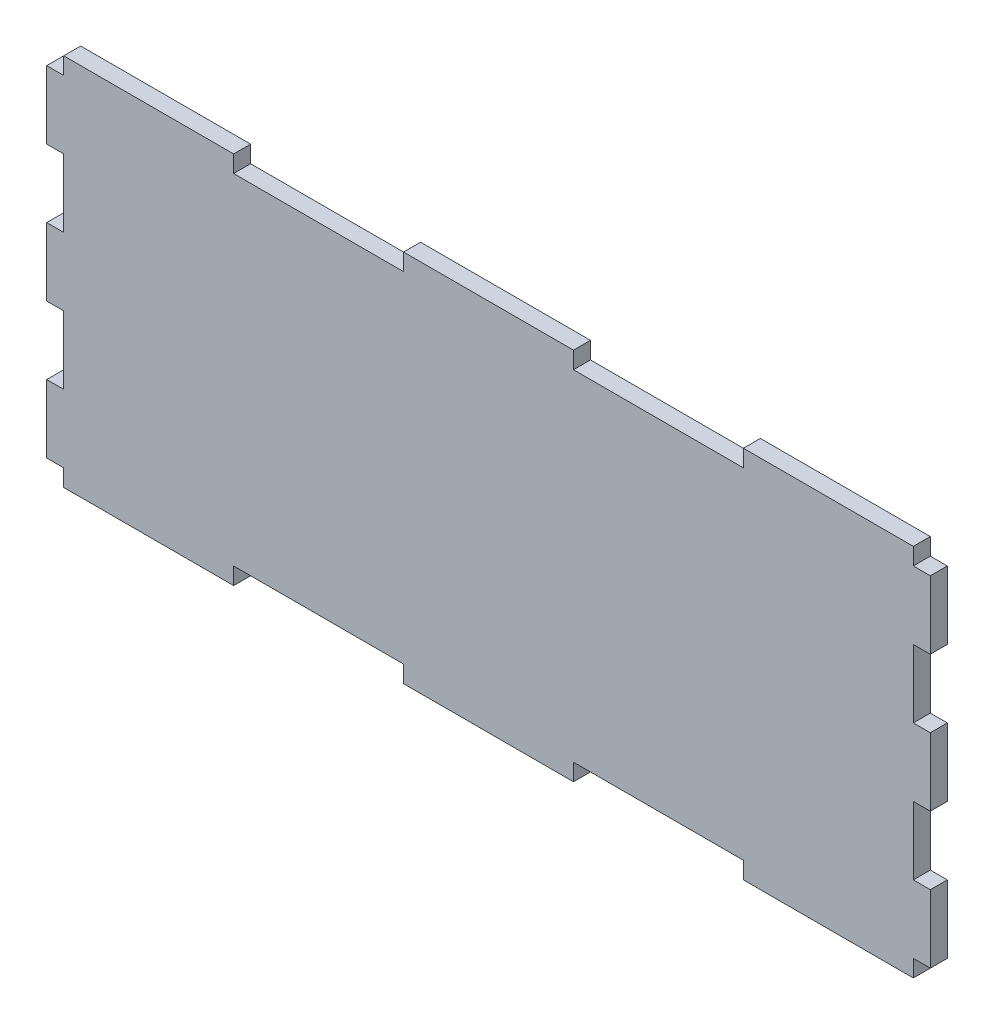
from build123d import *

# Parameters (mm, degrees)
RESSALTO_EXTRUS_O1_DEPTH = 3


with BuildPart() as part:
    # Esboço1 → Ressalto-extrusão1 (new body)
    with BuildSketch(Plane.XY):
        Polygon((40.700385396, -30), (10.700385396, -30), (10.700385396, -33), (-19.299614604, -33), (-19.299614604, -30), (-49.299614604, -30), (-49.299614604, -33), (-79.299614604, -33), (-79.299614604, -30), (-82.299614604, -30), (-82.299614604, -18), (-79.299614604, -18), (-79.299614604, -6), (-82.299614604, -6), (-82.299614604, 6), (-79.299614604, 6), (-79.299614604, 18), (-82.299614604, 18), (-82.299614604, 30), (-79.299614604, 30), (-79.299614604, 33), (-49.299614604, 33), (-49.299614604, 30), (-19.299614604, 30), (-19.299614604, 33), (10.700385396, 33), (10.700385396, 30), (40.700385396, 30), (40.700385396, 33), (70.700385396, 33), (70.700385396, 30), (73.700385396, 30), (73.700385396, 18), (70.700385396, 18), (70.700385396, 6), (73.700385396, 6), (73.700385396, -6), (70.700385396, -6), (70.700385396, -18), (73.700385396, -18), (73.700385396, -30), (70.700385396, -30), (70.700385396, -33), (40.700385396, -33), align=None)
    extrude(amount=RESSALTO_EXTRUS_O1_DEPTH)


solid = part.part
